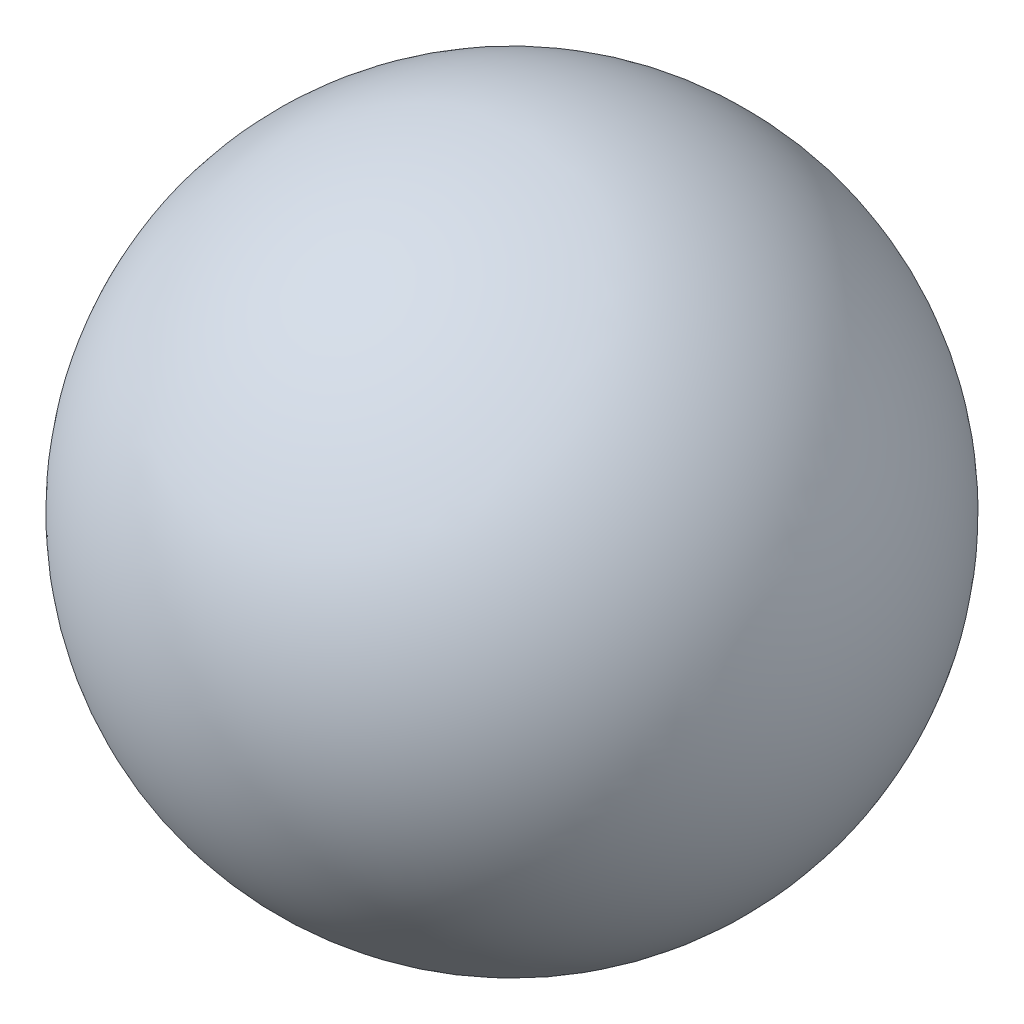
from build123d import *


with BuildPart() as part:
    # Sketch2 → Revolve1 (revolve)
    with BuildSketch(Plane.XY):
        with BuildLine():
            Line((-139.7, 0), (139.7, 0))
            ThreePointArc((139.7, 0), (0, 139.7), (-139.7, 0))
        make_face()
    revolve(axis=Axis((-139.7, 0, 0), (1, 0, 0)))


solid = part.part
